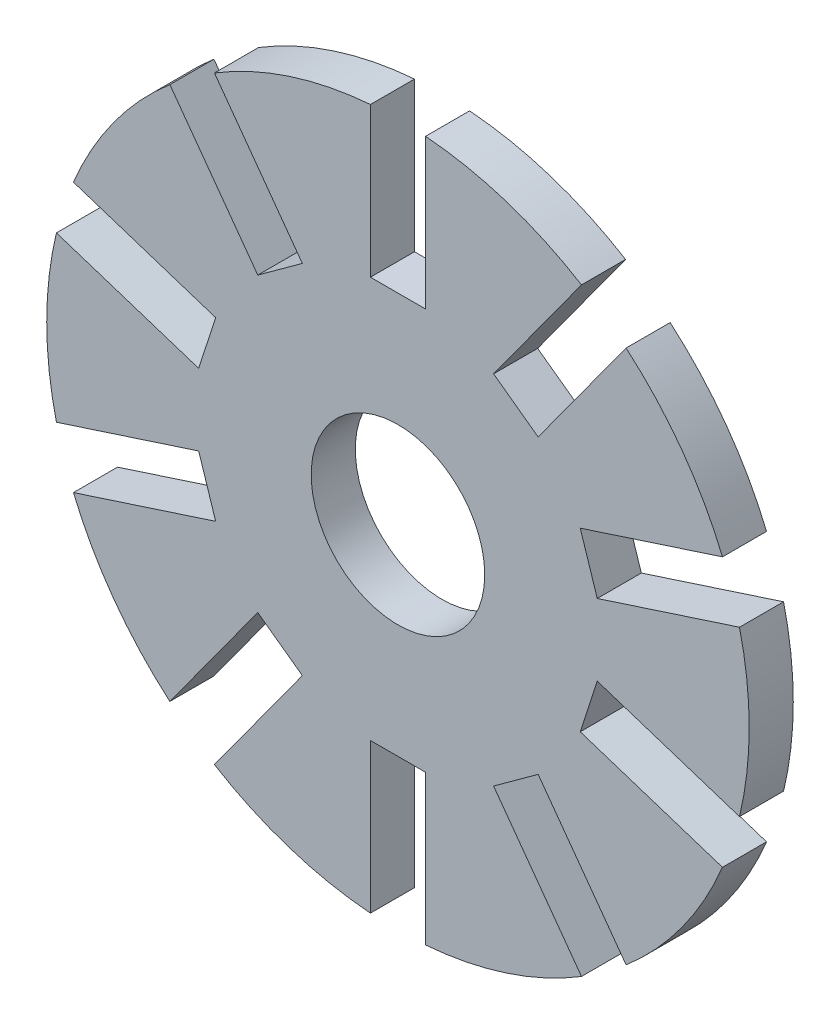
from build123d import *

# Parameters (mm, degrees)
SKETCH_1_R          = 12.75
SKETCH_1_R_2        = 3.15
EXTRUDE_1_DEPTH     = 1.6
SKETCH_3_W          = 2
SKETCH_3_H          = 5.467924172
CUT_EXTRUDE_3_DEPTH = 19.102071705


with BuildPart() as part:
    # Эскиз1 → Бобышка-Вытянуть1 (new body)
    with BuildSketch(Plane.XY):
        Circle(SKETCH_1_R)
        Circle(SKETCH_1_R_2, mode=Mode.SUBTRACT)
    extrude(amount=EXTRUDE_1_DEPTH)

    # Эскиз3 → Вырез-Вытянуть-Тонкостенный3 (cut, through all)
    with BuildSketch(Plane(origin=(0, 0, 0), x_dir=(-1, 0, 0), z_dir=(0, 0, -1))):
        with Locations((0, -10.016037914)):
            Rectangle(SKETCH_3_W, SKETCH_3_H)
        Polygon((-6.685244972, -10.902751931), (-3.471279784, -6.479108352), (-5.089313772, -5.303537847), (-8.303278961, -9.727181426), align=None)
        Polygon((-11.816953588, -4.891023195), (-6.616648674, -3.201341702), (-7.234682663, -1.299228669), (-12.434987577, -2.988910162), align=None)
        Polygon((-12.434987577, 2.988910162), (-7.234682663, 1.299228669), (-6.616648674, 3.201341702), (-11.816953588, 4.891023195), align=None)
        Polygon((-8.303278961, 9.727181426), (-5.089313772, 5.303537847), (-3.471279784, 6.479108352), (-6.685244972, 10.902751931), align=None)
        with Locations((0, 10.016037914)):
            Rectangle(SKETCH_3_W, SKETCH_3_H)
        Polygon((6.685244972, 10.902751931), (3.471279784, 6.479108352), (5.089313772, 5.303537847), (8.303278961, 9.727181426), align=None)
        Polygon((11.816953588, 4.891023195), (6.616648674, 3.201341702), (7.234682663, 1.299228669), (12.434987577, 2.988910162), align=None)
        Polygon((12.434987577, -2.988910162), (7.234682663, -1.299228669), (6.616648674, -3.201341702), (11.816953588, -4.891023195), align=None)
        Polygon((8.303278961, -9.727181426), (5.089313772, -5.303537847), (3.471279784, -6.479108352), (6.685244972, -10.902751931), align=None)
    extrude(amount=-CUT_EXTRUDE_3_DEPTH, mode=Mode.SUBTRACT)


solid = part.part
